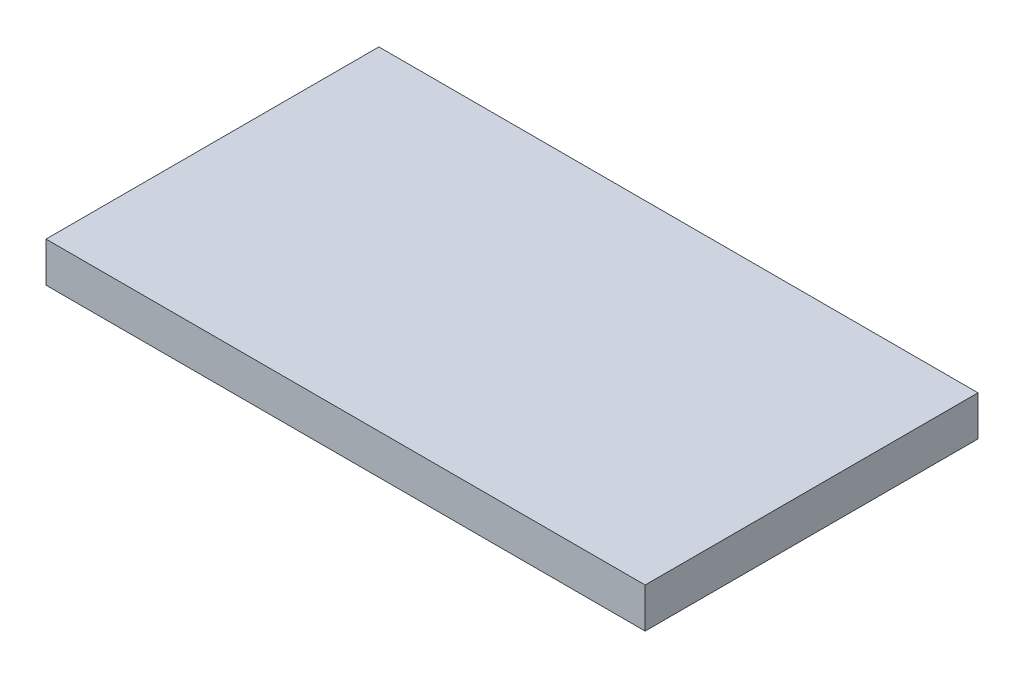
from build123d import *

# Parameters (mm, degrees)
CROQUIS1_W              = 45
CROQUIS1_H              = 25
SALIENTE_EXTRUIR1_DEPTH = 1.5


with BuildPart() as part:
    # Croquis1 → Saliente-Extruir1 (new, symmetric)
    with BuildSketch(Plane(origin=(0, 0, 0), x_dir=(1, 0, 0), z_dir=(0, 1, 0))):
        Rectangle(CROQUIS1_W, CROQUIS1_H)
    extrude(amount=SALIENTE_EXTRUIR1_DEPTH, both=True)


solid = part.part
